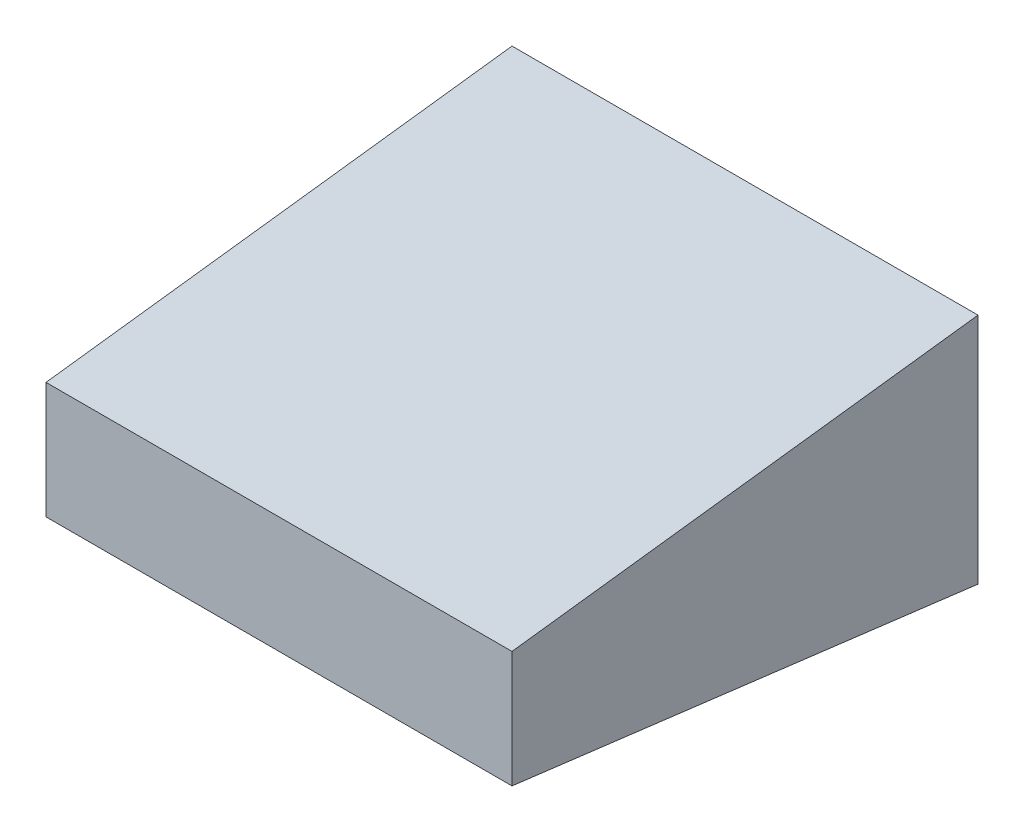
from build123d import *

# Parameters (mm, degrees)
CROQUIS1_W              = 200
CROQUIS1_H              = 100
SALIENTE_EXTRUIR1_DEPTH = 200
CORTAR_EXTRUIR1_DEPTH   = 200
CORTAR_EXTRUIR2_DEPTH   = 200
VACIADO1_T              = 4


with BuildPart() as part:
    # Croquis1 → Saliente-Extruir1 (new body)
    with BuildSketch(Plane.XY):
        Rectangle(CROQUIS1_W, CROQUIS1_H)
    extrude(amount=SALIENTE_EXTRUIR1_DEPTH)

    # Croquis18 → Cortar-Extruir1 (cut)
    with BuildSketch(Plane.ZY.offset(100)):
        Polygon((0, 50), (200, 50), (200, 25), align=None)
    extrude(amount=-CORTAR_EXTRUIR1_DEPTH, mode=Mode.SUBTRACT)

    # Croquis20 → Cortar-Extruir2 (cut)
    with BuildSketch(Plane.ZY.offset(100)):
        Polygon((0, -50), (200, -50), (200, -25), align=None)
    extrude(amount=-CORTAR_EXTRUIR2_DEPTH, mode=Mode.SUBTRACT)

    # Vaciado1 (no face opened: a closed hollow body)
    add(offset(amount=-VACIADO1_T, mode=Mode.PRIVATE), mode=Mode.SUBTRACT)


solid = part.part
